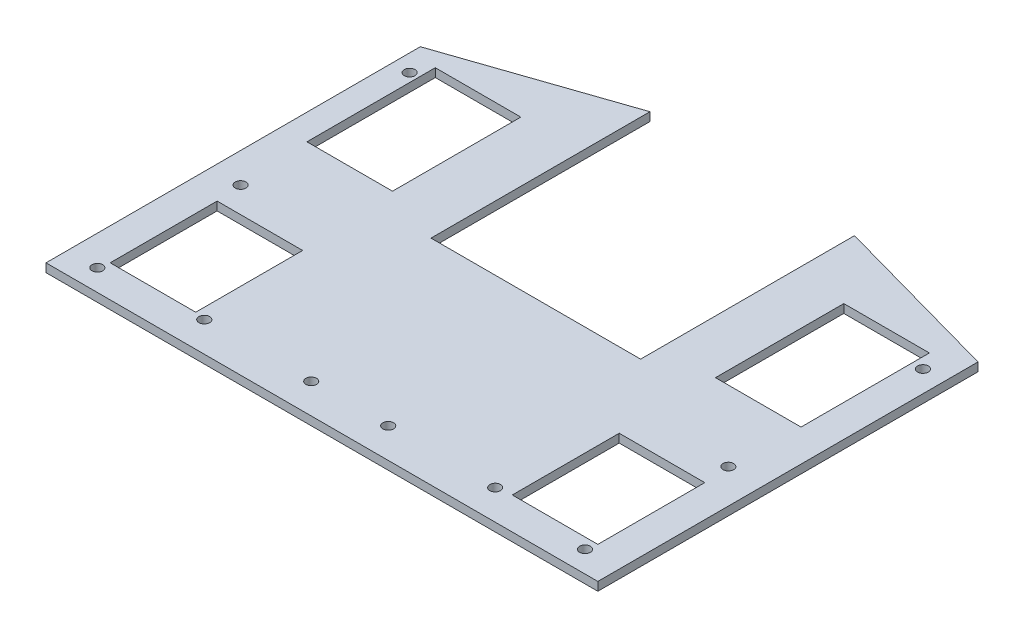
from build123d import *

# Parameters (mm, degrees)
SKETCH1_R           = 2.5
SKETCH1_W           = 40
SKETCH1_H           = 50
SKETCH1_H_2         = 60
BOSS_EXTRUDE1_DEPTH = 4


with BuildPart() as part:
    # Sketch1 → Boss-Extrude1 (new body)
    with BuildSketch(Plane(origin=(0, 0, 0), x_dir=(1, 0, 0), z_dir=(0, 1, 0))):
        Polygon((-48, 102.368421053), (-48, 0), (50, 0), (50, 100), (130, 77.738349066), (130, -100), (-128, -100), (-128, 75), align=None)
        with Locations(Location((-114, -90, 0), (0, 0, 270))):
            Circle(SKETCH1_R, mode=Mode.SUBTRACT)
        with Locations(Location((-68, -86, 0), (0, 0, 270))):
            Circle(SKETCH1_R, mode=Mode.SUBTRACT)
        with Locations(Location((-18, -86, 0), (0, 0, 270))):
            Circle(SKETCH1_R, mode=Mode.SUBTRACT)
        with Locations(Location((-120, 62, 0), (0, 0, 270))):
            Circle(SKETCH1_R, mode=Mode.SUBTRACT)
        with Locations(Location((-114, -23, 0), (0, 0, 270))):
            Circle(SKETCH1_R, mode=Mode.SUBTRACT)
        with Locations(Location((18, -86, 0), (0, 0, 90))):
            Circle(SKETCH1_R, mode=Mode.SUBTRACT)
        with Locations(Location((68, -86, 0), (0, 0, 90))):
            Circle(SKETCH1_R, mode=Mode.SUBTRACT)
        with Locations(Location((114, -90, 0), (0, 0, 90))):
            Circle(SKETCH1_R, mode=Mode.SUBTRACT)
        with Locations(Location((114, -23, 0), (0, 0, 90))):
            Circle(SKETCH1_R, mode=Mode.SUBTRACT)
        with Locations(Location((120, 62, 0), (0, 0, 90))):
            Circle(SKETCH1_R, mode=Mode.SUBTRACT)
        with Locations((95, -60)):
            Rectangle(SKETCH1_W, SKETCH1_H, mode=Mode.SUBTRACT)
        with Locations((95, 40)):
            Rectangle(SKETCH1_W, SKETCH1_H_2, mode=Mode.SUBTRACT)
        with Locations((-96, 40)):
            Rectangle(SKETCH1_W, SKETCH1_H_2, mode=Mode.SUBTRACT)
        with Locations((-93, -60)):
            Rectangle(SKETCH1_W, SKETCH1_H, mode=Mode.SUBTRACT)
    extrude(amount=BOSS_EXTRUDE1_DEPTH)


solid = part.part
